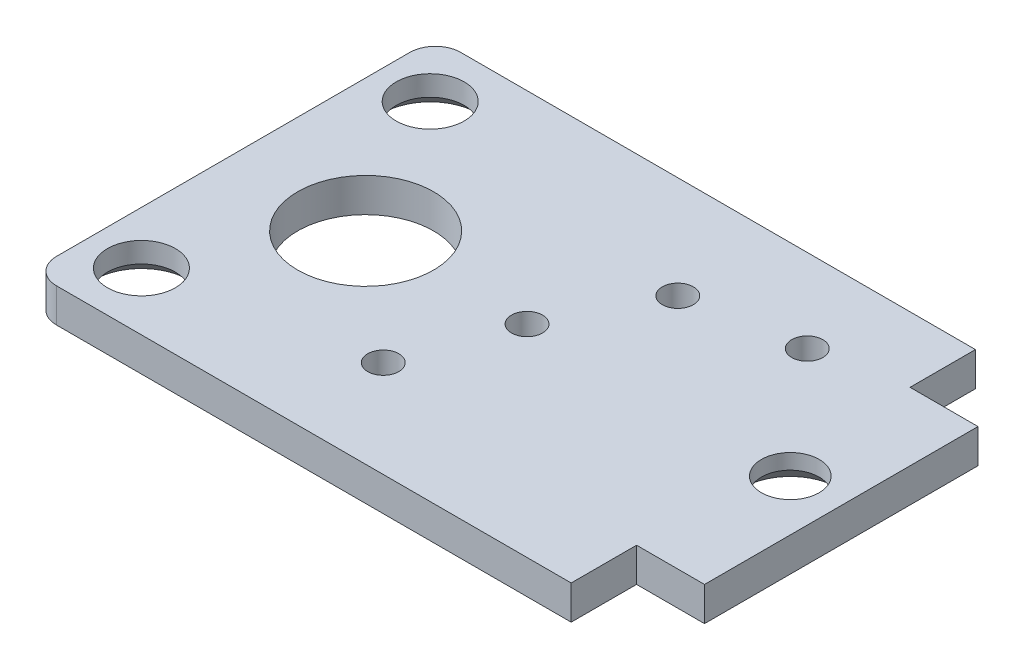
from build123d import *

# Parameters (mm, degrees)
SKETCH1_R           = 2
BOSS_EXTRUDE1_DEPTH = 1
SKETCH2_R           = 1
CUT_EXTRUDE1_DEPTH  = 16.244753196
FILLET1_R           = 0.75
CHAMFER1_SIZE       = 0.4
SKETCH3_R           = 0.4572
CUT_EXTRUDE2_DEPTH  = 16.244753196


with BuildPart() as part:
    # Sketch1 → Boss-Extrude1 (new body)
    with BuildSketch(Plane(origin=(0, 0, 0), x_dir=(1, 0, 0), z_dir=(0, 1, 0))):
        Polygon((12, 5.95), (-3.9, 5.95), (-3.9, -5.95), (12, -5.95), (12, -4.025), (14, -4.025), (14, 4.025), (12, 4.025), align=None)
        with Locations(Location((0, 0, 0), (0, 0, 270))):
            Circle(SKETCH1_R, mode=Mode.SUBTRACT)
    extrude(amount=BOSS_EXTRUDE1_DEPTH)

    # Sketch2 → Cut-Extrude1 (cut, through all)
    with BuildSketch(Plane(origin=(0, 1, 0), x_dir=(1, 0, 0), z_dir=(0, 1, 0))):
        with Locations(Location((-2.35, 4.25, 0), (0, 0, 270))):
            Circle(SKETCH2_R)
        with Locations(Location((-2.35, -4.25, 0), (0, 0, 270))):
            Circle(SKETCH2_R)
    extrude(amount=-CUT_EXTRUDE1_DEPTH, mode=Mode.SUBTRACT)

    # Fillet1
    fillet1_edges = [part.edges().sort_by_distance(p)[0] for p in [
        (-3.9, 0.5, -5.95),
        (-3.9, 0.5, 5.95),
    ]]
    fillet(fillet1_edges, radius=FILLET1_R)

    # Chamfer1
    chamfer1_edges = [part.edges().sort_by_distance(p)[0] for p in [
        (-2.35, 0, -5.25),
        (-2.35, 0, 3.25),
    ]]
    chamfer(chamfer1_edges, length=CHAMFER1_SIZE)

    # Sketch3 → Cut-Extrude2 (cut, through all)
    with BuildSketch(Plane(origin=(0, 1, 0), x_dir=(1, 0, 0), z_dir=(0, 1, 0))):
        with Locations(Location((3.61862915, -3.1, 0), (0, 0, 270))):
            Circle(SKETCH3_R)
        with Locations(Location((4.75, 0, 0), (0, 0, 270))):
            Circle(SKETCH3_R)
        with Locations(Location((6.247772136, 2.94052353, 0), (0, 0, 270))):
            Circle(SKETCH3_R)
        with Locations(Location((9.5, 3.5, 0), (0, 0, 270))):
            Circle(SKETCH3_R)
    extrude(amount=-CUT_EXTRUDE2_DEPTH, mode=Mode.SUBTRACT)

    # Sketch5 → CSK for M1.6 Countersunk Raised Head Screw2 (revolve, cut)
    with BuildSketch(Plane(origin=(12.5, 0, 0), x_dir=(0, 0, -1), z_dir=(1, 0, 0))):
        Polygon((0, 0), (0, 1), (0.85, 1), (0.85, 0.55), (1.4, 0), align=None)
    revolve(axis=Axis((12.5, -6.35, 0), (0, 1, 0)), mode=Mode.SUBTRACT)


solid = part.part
